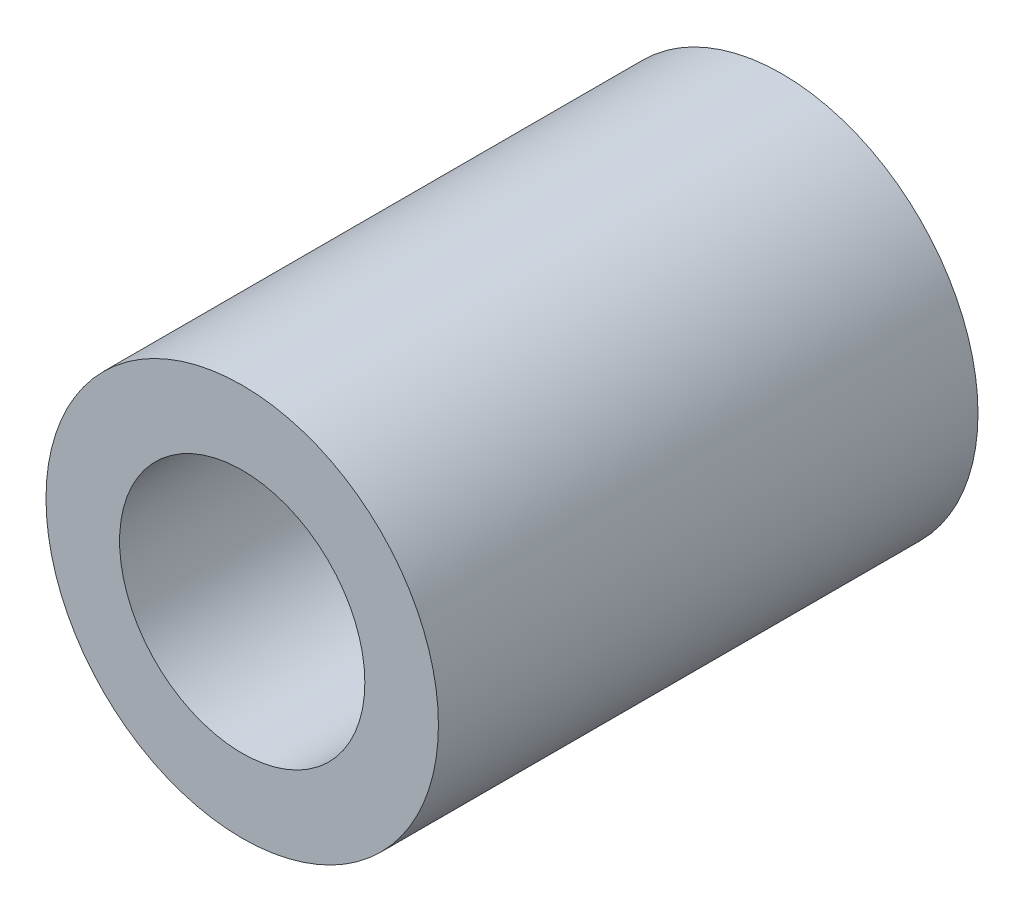
from build123d import *

# Parameters (mm, degrees)
SKETCH1_R           = 8
SKETCH1_R_2         = 5
BOSS_EXTRUDE1_DEPTH = 11


with BuildPart() as part:
    # Sketch1 → Boss-Extrude1 (new, symmetric)
    with BuildSketch(Plane.XY):
        Circle(SKETCH1_R)
        Circle(SKETCH1_R_2, mode=Mode.SUBTRACT)
    extrude(amount=BOSS_EXTRUDE1_DEPTH, both=True)


solid = part.part
